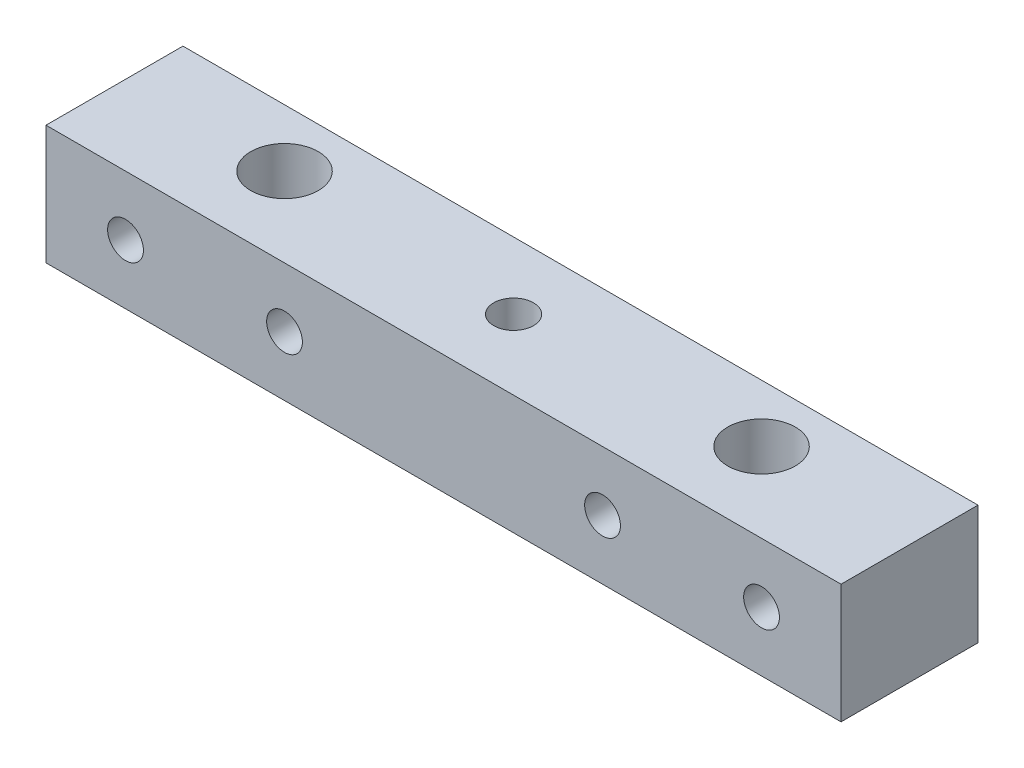
from build123d import *

# Parameters (mm, degrees)
SKETCH1_W                               = 100
SKETCH1_H                               = 17.228
BOSS_EXTRUDE1_DEPTH                     = 15
CBORE_FOR_M5_HEX_HEAD_BOLT1_D           = 4.5
CBORE_FOR_M5_HEX_HEAD_BOLT1_CBORE_D     = 8.5
CBORE_FOR_M5_HEX_HEAD_BOLT1_CBORE_DEPTH = 6
M4_CLEARANCE_HOLE1_D                    = 4.5
CBORE_FOR_M5_HEX_HEAD_BOLT2_D           = 4.5
CBORE_FOR_M5_HEX_HEAD_BOLT2_CBORE_D     = 5
CBORE_FOR_M5_HEX_HEAD_BOLT2_CBORE_DEPTH = 4.2


with BuildPart() as part:
    # Sketch1 → Boss-Extrude1 (new body)
    with BuildSketch(Plane(origin=(0, 0, 0), x_dir=(1, 0, 0), z_dir=(0, 1, 0))):
        Rectangle(SKETCH1_W, SKETCH1_H)
    extrude(amount=BOSS_EXTRUDE1_DEPTH)

    # CBORE for M5 Hex Head Bolt1 (through all)
    with Locations(Plane(origin=(0, 15, 0), x_dir=(1, 0, 0), z_dir=(0, 1, 0))):
        with Locations((-30, 1.386), (30, 1.386)):
            CounterBoreHole(CBORE_FOR_M5_HEX_HEAD_BOLT1_D / 2, CBORE_FOR_M5_HEX_HEAD_BOLT1_CBORE_D / 2, CBORE_FOR_M5_HEX_HEAD_BOLT1_CBORE_DEPTH)

    # M4 Clearance Hole1 (through all)
    with Locations(Plane.XY.offset(8.614)):
        with Locations((-20, 7.5), (20, 7.5), (-40, 7.5), (40, 7.5)):
            Hole(M4_CLEARANCE_HOLE1_D / 2)

    # CBORE for M5 Hex Head Bolt2 (through all)
    with Locations(Plane(origin=(0, 15, 0), x_dir=(1, 0, 0), z_dir=(0, 1, 0))):
        with Locations((0, 0.2)):
            CounterBoreHole(CBORE_FOR_M5_HEX_HEAD_BOLT2_D / 2, CBORE_FOR_M5_HEX_HEAD_BOLT2_CBORE_D / 2, CBORE_FOR_M5_HEX_HEAD_BOLT2_CBORE_DEPTH)


solid = part.part
